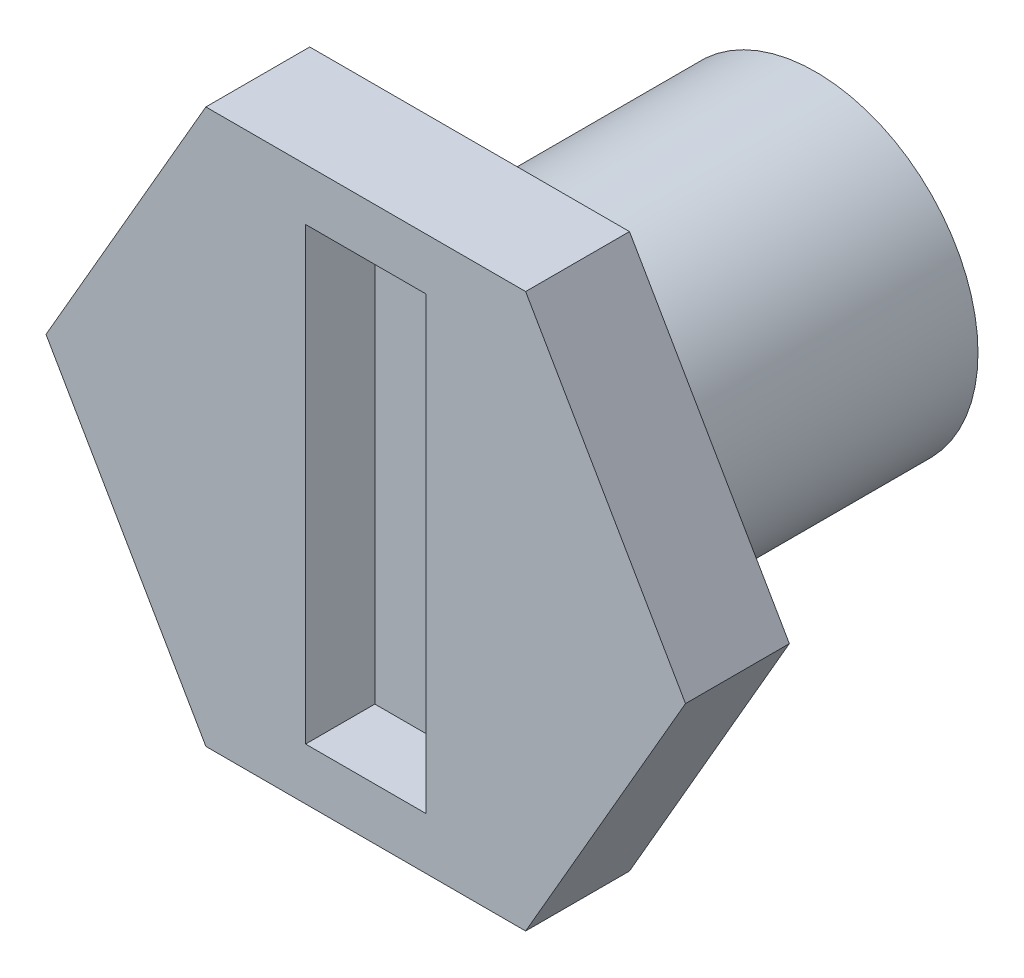
from build123d import *

# Parameters (mm, degrees)
SKETCH1_R           = 46.875
BOSS_EXTRUDE1_DEPTH = 100
BOSS_EXTRUDE2_DEPTH = 30
SKETCH3_W           = 34.75208614
SKETCH3_H           = 130
CUT_EXTRUDE1_DEPTH  = 20


with BuildPart() as part:
    # Sketch1 → Boss-Extrude1 (new body)
    with BuildSketch(Plane.XY):
        Circle(SKETCH1_R)
    extrude(amount=BOSS_EXTRUDE1_DEPTH)

    # Sketch2 → Boss-Extrude2 (add)
    with BuildSketch(Plane.XY.offset(100)):
        Polygon((92.37604307, 0), (46.188021535, 80), (-46.188021535, 80), (-92.37604307, 0), (-46.188021535, -80), (46.188021535, -80), align=None)
    extrude(amount=BOSS_EXTRUDE2_DEPTH)

    # Sketch3 → Cut-Extrude1 (cut)
    with BuildSketch(Plane.XY.offset(130)):
        Rectangle(SKETCH3_W, SKETCH3_H)
    extrude(amount=-CUT_EXTRUDE1_DEPTH, mode=Mode.SUBTRACT)


solid = part.part
